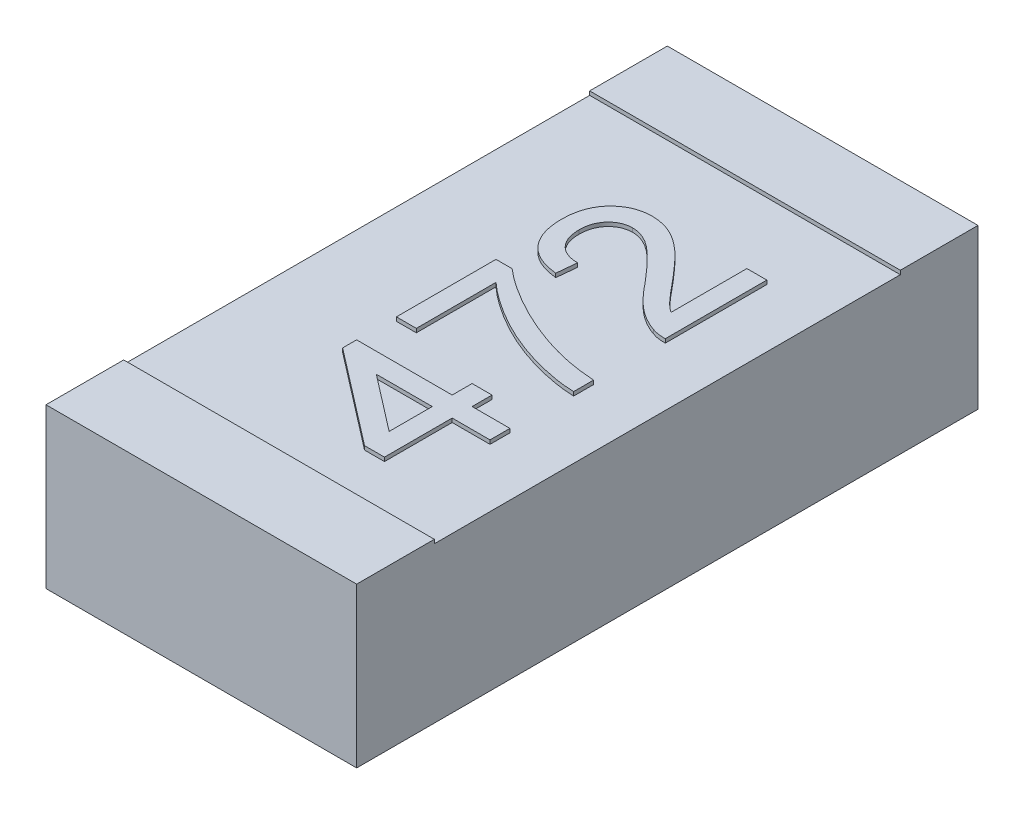
from build123d import *

# Parameters (mm, degrees)
SKETCH_1_W      = 0.8
SKETCH_1_H      = 1.6
EXTRUDE_1_DEPTH = 0.4
SKETCH_2_W      = 0.8
SKETCH_2_H      = 0.2
EXTRUDE_2_DEPTH = 0.01


with BuildPart() as part:
    # Эскиз1 → Бобышка-Вытянуть1 (new body)
    with BuildSketch(Plane(origin=(0, 0, 0), x_dir=(1, 0, 0), z_dir=(0, 1, 0))):
        with Locations((-3.546666667, 0.56)):
            Rectangle(SKETCH_1_W, SKETCH_1_H)
    extrude(amount=EXTRUDE_1_DEPTH)

    # Эскиз2 → Бобышка-Вытянуть2 (add)
    # profile 1 of 5: a face of its own
    with BuildSketch(Plane(origin=(0, 0.4, 0), x_dir=(1, 0, 0), z_dir=(0, 1, 0))):
        with Locations((-3.546666667, 1.26)):
            Rectangle(SKETCH_2_W, SKETCH_2_H)
    # profile 2 of 5: a face of its own
    with BuildSketch(Plane(origin=(0, 0.4, 0), x_dir=(1, 0, 0), z_dir=(0, 1, 0))):
        with Locations((-3.546666667, -0.14)):
            Rectangle(SKETCH_2_W, SKETCH_2_H)
    # profile 3 of 5: a face of its own
    with BuildSketch(Plane(origin=(0, 0.4, 0), x_dir=(1, 0, 0), z_dir=(0, 1, 0))):
        with BuildLine():
            Line((-3.347948718, 0.96619925), (-3.296666667, 0.96619925))
            Line((-3.296666667, 0.96619925), (-3.296666667, 0.704660789))
            add(Edge.make_bspline(
                [(-3.296666667, 0.704660789), (-3.299714721, 0.704653678), (-3.305774032, 0.704639541), (-3.314770725, 0.705690594), (-3.323656392, 0.707274517), (-3.329375637, 0.709109309), (-3.33224359, 0.710029379)],
                knots=[0, 0, 0, 0, 1.010600758, 2.009000657, 3.001600101, 4, 4, 4, 4], degree=3))
            add(Edge.make_bspline(
                [(-3.33224359, 0.710029379), (-3.336932362, 0.711721718), (-3.346456969, 0.715159476), (-3.360187488, 0.722229591), (-3.373915942, 0.730387016), (-3.38506487, 0.738436812), (-3.393967559, 0.745776399), (-3.400931315, 0.751934453), (-3.408059998, 0.758757865), (-3.415351725, 0.766242173), (-3.422853891, 0.774315053), (-3.430591465, 0.782987605), (-3.438420265, 0.792362213), (-3.443609519, 0.798906673), (-3.446266026, 0.802256943)],
                knots=[0, 0, 0, 0, 1.204682444, 2.447149603, 3.728063212, 5.065745198, 5.768097617, 6.518745349, 7.313897871, 8.154576377, 9.046034033, 9.979646649, 10.965731253, 12, 12, 12, 12], degree=3))
            add(Edge.make_bspline(
                [(-3.446266026, 0.802256943), (-3.45059804, 0.807403785), (-3.458939607, 0.817314355), (-3.471317716, 0.831309641), (-3.482811507, 0.84409203), (-3.493622362, 0.855458095), (-3.503645651, 0.865500412), (-3.512857936, 0.874243792), (-3.521232754, 0.881759597), (-3.529066081, 0.887968052), (-3.536461335, 0.89316514), (-3.543635002, 0.897677348), (-3.550838276, 0.901299603), (-3.55793436, 0.904408042), (-3.564951278, 0.906819597), (-3.571951879, 0.908516787), (-3.578869895, 0.909613508), (-3.583495036, 0.909731149), (-3.585769231, 0.909788994)],
                knots=[0, 0, 0, 0, 1.782511555, 3.432339066, 4.950556168, 6.337242158, 7.588364383, 8.709771971, 9.70247892, 10.569050646, 11.3564271, 12.096888545, 12.812232926, 13.490631961, 14.148641375, 14.7751826, 15.397753892, 16, 16, 16, 16], degree=3))
            add(Edge.make_bspline(
                [(-3.585769231, 0.909788994), (-3.588017262, 0.909733321), (-3.592427777, 0.909624092), (-3.598882449, 0.908587524), (-3.605098798, 0.907145011), (-3.610963294, 0.904811094), (-3.616655693, 0.902039253), (-3.621990535, 0.898447859), (-3.627169376, 0.894382659), (-3.631921404, 0.889633661), (-3.636373741, 0.884482269), (-3.640098955, 0.87875047), (-3.643320365, 0.872720515), (-3.646025422, 0.866331302), (-3.647986405, 0.859488111), (-3.649417628, 0.852277685), (-3.650323049, 0.844694102), (-3.650448604, 0.839519116), (-3.650512821, 0.836872327)],
                knots=[0, 0, 0, 0, 0.987973548, 1.938350371, 2.870100611, 3.788647624, 4.708095761, 5.649791829, 6.611214459, 7.599816467, 8.600146238, 9.60047601, 10.599079585, 11.604913276, 12.645813302, 13.724097821, 14.835971573, 16, 16, 16, 16], degree=3))
            add(Edge.make_bspline(
                [(-3.650512821, 0.836872327), (-3.650448919, 0.83409195), (-3.65032386, 0.828650546), (-3.649414862, 0.820696253), (-3.648022672, 0.8131466), (-3.645906086, 0.806012387), (-3.643203711, 0.799339736), (-3.639949776, 0.793050051), (-3.636123517, 0.787190009), (-3.631628174, 0.781842581), (-3.626633448, 0.777010688), (-3.621196547, 0.772724047), (-3.615197435, 0.769184165), (-3.608751543, 0.766323888), (-3.601899236, 0.763966526), (-3.594572456, 0.762276504), (-3.586780767, 0.761351474), (-3.581444563, 0.761165878), (-3.578717949, 0.761071045)],
                knots=[0, 0, 0, 0, 1.130801575, 2.213061782, 3.252933619, 4.249917472, 5.234510032, 6.17726912, 7.126517163, 8.075267631, 9.012689889, 9.949419277, 10.884824487, 11.837981854, 12.813782694, 13.828488442, 14.890433304, 16, 16, 16, 16], degree=3))
            Line((-3.578717949, 0.761071045), (-3.583846154, 0.709788994))
            add(Edge.make_bspline(
                [(-3.583846154, 0.709788994), (-3.588315516, 0.710313674), (-3.597010277, 0.711334394), (-3.609603065, 0.71387702), (-3.621318367, 0.717446081), (-3.632317675, 0.721718641), (-3.642420269, 0.727067939), (-3.6518288, 0.733149711), (-3.660309503, 0.740238528), (-3.66800975, 0.74812715), (-3.674692755, 0.756896835), (-3.680625157, 0.766339148), (-3.685570315, 0.776564159), (-3.689671345, 0.787474273), (-3.692781161, 0.799101959), (-3.695011662, 0.811428697), (-3.696386448, 0.824474892), (-3.696571928, 0.833423413), (-3.696666667, 0.837994122)],
                knots=[0, 0, 0, 0, 1.130730993, 2.199739822, 3.223355253, 4.205635214, 5.160465258, 6.091399258, 7.016214058, 7.932437584, 8.856204186, 9.781944312, 10.73064304, 11.705670886, 12.707145581, 13.751268262, 14.851396981, 16, 16, 16, 16], degree=3))
            add(Edge.make_bspline(
                [(-3.696666667, 0.837994122), (-3.696587462, 0.842619542), (-3.69643317, 0.851629887), (-3.694854453, 0.864759408), (-3.692395617, 0.877147474), (-3.688968751, 0.888839497), (-3.684475113, 0.89976641), (-3.678984885, 0.909936577), (-3.672551696, 0.919397044), (-3.66509805, 0.927989176), (-3.656961938, 0.935738546), (-3.648276111, 0.94252391), (-3.639070222, 0.948230333), (-3.629462356, 0.952997663), (-3.619322428, 0.956642507), (-3.608726584, 0.959140325), (-3.597657153, 0.96085828), (-3.590102935, 0.960999181), (-3.58625, 0.961071045)],
                knots=[0, 0, 0, 0, 1.195413282, 2.328672114, 3.413490698, 4.457927086, 5.473612634, 6.462365753, 7.441157041, 8.42539015, 9.397434444, 10.3422866, 11.269742116, 12.193178192, 13.110630063, 14.048592791, 15.004708964, 16, 16, 16, 16], degree=3))
            add(Edge.make_bspline(
                [(-3.58625, 0.961071045), (-3.582291584, 0.96096106), (-3.574366015, 0.960740846), (-3.562521371, 0.959013923), (-3.550822762, 0.956087583), (-3.539112888, 0.952123006), (-3.527293622, 0.946848171), (-3.51526789, 0.940068453), (-3.502985529, 0.931735692), (-3.492609351, 0.923636931), (-3.483861017, 0.916172703), (-3.476660227, 0.909501035), (-3.46892387, 0.901874967), (-3.460562632, 0.893403332), (-3.451769433, 0.883875186), (-3.442303631, 0.873514434), (-3.432403514, 0.862105379), (-3.425640701, 0.854184786), (-3.422147436, 0.850093481)],
                knots=[0, 0, 0, 0, 0.927158598, 1.856363277, 2.797335015, 3.749167701, 4.749227661, 5.825023649, 6.979171586, 8.223362362, 8.906844726, 9.672958766, 10.52256342, 11.451810239, 12.461281865, 13.559912207, 14.739596516, 16, 16, 16, 16], degree=3))
            add(Edge.make_bspline(
                [(-3.422147436, 0.850093481), (-3.4193034, 0.84658306), (-3.413869486, 0.839875929), (-3.405878123, 0.830460357), (-3.398751822, 0.821860159), (-3.392389028, 0.814181288), (-3.386661568, 0.807485977), (-3.381635635, 0.801770745), (-3.377396759, 0.79693144), (-3.370792529, 0.789705237), (-3.361369328, 0.780582945), (-3.352291495, 0.773780445), (-3.347948718, 0.770526173)],
                knots=[0, 0, 0, 0, 1.242067915, 2.373138023, 3.395138797, 4.312776638, 5.114836229, 5.81737152, 6.405241861, 6.883397567, 8.50903741, 10, 10, 10, 10], degree=3))
            Line((-3.347948718, 0.770526173), (-3.347948718, 0.96619925))
        make_face()
    # profile 4 of 5: a face of its own
    with BuildSketch(Plane(origin=(0, 0.4, 0), x_dir=(1, 0, 0), z_dir=(0, 1, 0))):
        with BuildLine():
            Line((-3.64025641, 0.407224891), (-3.691538462, 0.407224891))
            Line((-3.691538462, 0.407224891), (-3.691538462, 0.663635148))
            Line((-3.691538462, 0.663635148), (-3.650032051, 0.663635148))
            add(Edge.make_bspline(
                [(-3.650032051, 0.663635148), (-3.646502021, 0.660616545), (-3.639284349, 0.654444563), (-3.627787933, 0.645502899), (-3.61554742, 0.636515998), (-3.60244882, 0.627635735), (-3.588592227, 0.61876604), (-3.573973239, 0.609833167), (-3.558531576, 0.600959048), (-3.536884197, 0.589255431), (-3.509140266, 0.575362882), (-3.475000597, 0.560856757), (-3.440531826, 0.54800689), (-3.417091589, 0.54116578), (-3.405400641, 0.537753738)],
                knots=[0, 0, 0, 0, 0.6032745, 1.233484441, 1.891357215, 2.57557336, 3.288734553, 4.028369461, 4.800843345, 5.601920993, 7.224937043, 8.829018402, 10.418455404, 12, 12, 12, 12], degree=3))
            add(Edge.make_bspline(
                [(-3.405400641, 0.537753738), (-3.396957321, 0.535541077), (-3.379780473, 0.531039703), (-3.353107004, 0.526112085), (-3.325295894, 0.522302305), (-3.306318462, 0.520806275), (-3.296666667, 0.520045404)],
                knots=[0, 0, 0, 0, 0.948866074, 1.930345965, 2.947387709, 4, 4, 4, 4], degree=3))
            Line((-3.296666667, 0.520045404), (-3.296666667, 0.468763353))
            add(Edge.make_bspline(
                [(-3.296666667, 0.468763353), (-3.300648464, 0.468886356), (-3.308836796, 0.469139305), (-3.321419039, 0.470257863), (-3.334626523, 0.471747682), (-3.34841463, 0.473851923), (-3.362811345, 0.47652659), (-3.377831929, 0.479713791), (-3.393445276, 0.483520299), (-3.415092317, 0.48914961), (-3.442310543, 0.497512223), (-3.474498855, 0.509677325), (-3.506137168, 0.52371432), (-3.531836702, 0.536987949), (-3.551768129, 0.548460586), (-3.566250592, 0.557079737), (-3.580059398, 0.565975659), (-3.593287523, 0.574947686), (-3.605942611, 0.584003547), (-3.617907266, 0.593326123), (-3.629421628, 0.60264096), (-3.636676667, 0.609144268), (-3.64025641, 0.612353097)],
                knots=[0, 0, 0, 0, 0.630310263, 1.296195935, 1.998233977, 2.733510572, 3.502865957, 4.315300234, 5.16313825, 6.045860881, 7.854817038, 9.665969389, 11.488229695, 13.329548187, 14.240214963, 15.127489952, 15.996309606, 16.839233987, 17.656863512, 18.458360632, 19.239332369, 20, 20, 20, 20], degree=3))
            Line((-3.64025641, 0.612353097), (-3.64025641, 0.407224891))
        make_face()
    # profile 5 of 5: a face of its own
    with BuildSketch(Plane(origin=(0, 0.4, 0), x_dir=(1, 0, 0), z_dir=(0, 1, 0))):
        Polygon((-3.296666667, 0.253378738), (-3.394102564, 0.253378738), (-3.394102564, 0.079019763), (-3.445384615, 0.079019763), (-3.691538462, 0.268763353), (-3.691538462, 0.304660789), (-3.445384615, 0.304660789), (-3.445384615, 0.35594284), (-3.394102564, 0.35594284), (-3.394102564, 0.304660789), (-3.296666667, 0.304660789), align=None)
        Polygon((-3.445384615, 0.253378738), (-3.589455128, 0.253378738), (-3.445384615, 0.142321045), align=None, mode=Mode.SUBTRACT)
    extrude(amount=EXTRUDE_2_DEPTH)


solid = part.part
